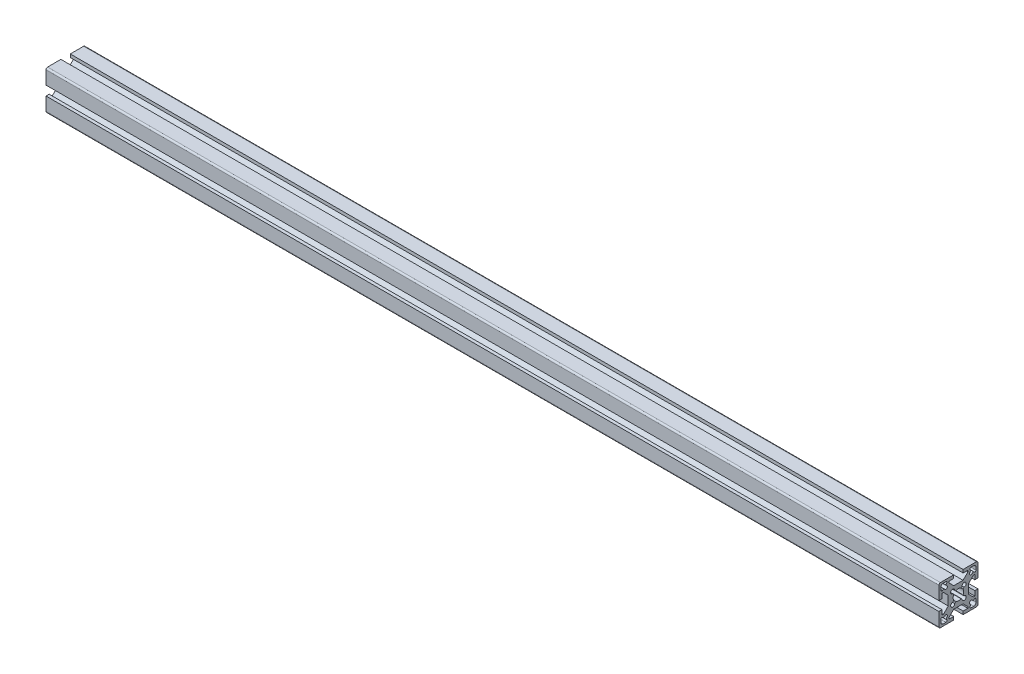
from build123d import *

# Parameters (mm, degrees)
BOSS_EXTRUDE1_DEPTH = 570


with BuildPart() as part:
    # Sketch1 → Boss-Extrude1 (new body)
    with BuildSketch(Plane(origin=(0, 0, 0), x_dir=(0, 0, -1), z_dir=(1, 0, 0))):
        with BuildLine():
            Line((-12.5, 11.5), (-12.5, 3))
            Line((-12.5, 3), (-10.5, 3))
            Line((-10.5, 3), (-10.5, 6))
            Line((-10.5, 6), (-9.535533906, 6))
            Line((-9.535533906, 6), (-6.5, 2.964466094))
            Line((-6.5, 2.964466094), (-6.5, -2.964466094))
            Line((-6.5, -2.964466094), (-9.535533906, -6))
            Line((-9.535533906, -6), (-10.5, -6))
            Line((-10.5, -6), (-10.5, -3))
            Line((-10.5, -3), (-12.5, -3))
            Line((-12.5, -3), (-12.5, -11.5))
            ThreePointArc((-12.5, -11.5), (-12.207106781, -12.207106781), (-11.5, -12.5))
            Line((-11.5, -12.5), (-3, -12.5))
            Line((-3, -12.5), (-3, -10.5))
            Line((-3, -10.5), (-6, -10.5))
            Line((-6, -10.5), (-6, -9.535533906))
            Line((-6, -9.535533906), (-2.964466094, -6.5))
            Line((-2.964466094, -6.5), (2.964466094, -6.5))
            Line((2.964466094, -6.5), (6, -9.535533906))
            Line((6, -9.535533906), (6, -10.5))
            Line((6, -10.5), (3, -10.5))
            Line((3, -10.5), (3, -12.5))
            Line((3, -12.5), (11.5, -12.5))
            ThreePointArc((11.5, -12.5), (12.207106781, -12.207106781), (12.5, -11.5))
            Line((12.5, -11.5), (12.5, -3))
            Line((12.5, -3), (10.5, -3))
            Line((10.5, -3), (10.5, -6))
            Line((10.5, -6), (9.535533906, -6))
            Line((9.535533906, -6), (6.5, -2.964466094))
            Line((6.5, -2.964466094), (6.5, 2.964466094))
            Line((6.5, 2.964466094), (9.535533906, 6))
            Line((9.535533906, 6), (10.5, 6))
            Line((10.5, 6), (10.5, 3))
            Line((10.5, 3), (12.5, 3))
            Line((12.5, 3), (12.5, 11.5))
            ThreePointArc((12.5, 11.5), (12.207106781, 12.207106781), (11.5, 12.5))
            Line((11.5, 12.5), (3, 12.5))
            Line((3, 12.5), (3, 10.5))
            Line((3, 10.5), (6, 10.5))
            Line((6, 10.5), (6, 9.535533906))
            Line((6, 9.535533906), (2.964466094, 6.5))
            Line((2.964466094, 6.5), (-2.964466094, 6.5))
            Line((-2.964466094, 6.5), (-6, 9.535533906))
            Line((-6, 9.535533906), (-6, 10.5))
            Line((-6, 10.5), (-3, 10.5))
            Line((-3, 10.5), (-3, 12.5))
            Line((-3, 12.5), (-11.5, 12.5))
            ThreePointArc((-11.5, 12.5), (-12.207106781, 12.207106781), (-12.5, 11.5))
        make_face()
        with BuildLine():
            Line((-3.087755464, -1.885673936), (-3.585519377, -2.383437849))
            ThreePointArc((-3.585519377, -2.383437849), (-4.599238816, -4.599238816), (-2.383437849, -3.585519377))
            Line((-2.383437849, -3.585519377), (-1.885673936, -3.087755464))
            ThreePointArc((-1.885673936, -3.087755464), (-1.720751743, -3.0036254), (-1.537849315, -3.032329053))
            ThreePointArc((-1.537849315, -3.032329053), (0, -3.4), (1.537849315, -3.032329053))
            ThreePointArc((1.537849315, -3.032329053), (1.720751743, -3.0036254), (1.885673936, -3.087755464))
            Line((1.885673936, -3.087755464), (2.383437849, -3.585519377))
            ThreePointArc((2.383437849, -3.585519377), (4.599238816, -4.599238816), (3.585519377, -2.383437849))
            Line((3.585519377, -2.383437849), (3.087755464, -1.885673936))
            ThreePointArc((3.087755464, -1.885673936), (3.0036254, -1.720751743), (3.032329053, -1.537849315))
            ThreePointArc((3.032329053, -1.537849315), (3.4, 0), (3.032329053, 1.537849315))
            ThreePointArc((3.032329053, 1.537849315), (3.0036254, 1.720751743), (3.087755464, 1.885673936))
            Line((3.087755464, 1.885673936), (3.585519377, 2.383437849))
            ThreePointArc((3.585519377, 2.383437849), (4.599238816, 4.599238816), (2.383437849, 3.585519377))
            Line((2.383437849, 3.585519377), (1.885673936, 3.087755464))
            ThreePointArc((1.885673936, 3.087755464), (1.720751743, 3.0036254), (1.537849315, 3.032329053))
            ThreePointArc((1.537849315, 3.032329053), (0, 3.4), (-1.537849315, 3.032329053))
            ThreePointArc((-1.537849315, 3.032329053), (-1.720751743, 3.0036254), (-1.885673936, 3.087755464))
            Line((-1.885673936, 3.087755464), (-2.383437849, 3.585519377))
            ThreePointArc((-2.383437849, 3.585519377), (-4.599238816, 4.599238816), (-3.585519377, 2.383437849))
            Line((-3.585519377, 2.383437849), (-3.087755464, 1.885673936))
            ThreePointArc((-3.087755464, 1.885673936), (-3.0036254, 1.720751743), (-3.032329053, 1.537849315))
            ThreePointArc((-3.032329053, 1.537849315), (-3.4, 0), (-3.032329053, -1.537849315))
            ThreePointArc((-3.032329053, -1.537849315), (-3.0036254, -1.720751743), (-3.087755464, -1.885673936))
        make_face(mode=Mode.SUBTRACT)
        with BuildLine():
            Line((-11.25, 9.75), (-11.25, 7.976197667))
            ThreePointArc((-11.25, 7.976197667), (-10.817878403, 7.329481994), (-10.055025253, 7.48122292))
            Line((-10.055025253, 7.48122292), (-9.475230868, 8.061017306))
            Line((-9.475230868, 8.061017306), (-8.768124087, 7.353910524))
            ThreePointArc((-8.768124087, 7.353910524), (-7.353910524, 7.353910524), (-7.353910524, 8.768124087))
            Line((-7.353910524, 8.768124087), (-8.061017306, 9.475230868))
            Line((-8.061017306, 9.475230868), (-7.48122292, 10.055025253))
            ThreePointArc((-7.48122292, 10.055025253), (-7.329481994, 10.817878403), (-7.976197667, 11.25))
            Line((-7.976197667, 11.25), (-9.75, 11.25))
            ThreePointArc((-9.75, 11.25), (-10.810660172, 10.810660172), (-11.25, 9.75))
        make_face(mode=Mode.SUBTRACT)
        with BuildLine():
            Line((8.061017306, 9.475230868), (7.353910524, 8.768124087))
            ThreePointArc((7.353910524, 8.768124087), (7.353910524, 7.353910524), (8.768124087, 7.353910524))
            Line((8.768124087, 7.353910524), (9.475230868, 8.061017306))
            Line((9.475230868, 8.061017306), (10.055025253, 7.48122292))
            ThreePointArc((10.055025253, 7.48122292), (10.817878403, 7.329481994), (11.25, 7.976197667))
            Line((11.25, 7.976197667), (11.25, 9.75))
            ThreePointArc((11.25, 9.75), (10.810660172, 10.810660172), (9.75, 11.25))
            Line((9.75, 11.25), (7.976197667, 11.25))
            ThreePointArc((7.976197667, 11.25), (7.329481994, 10.817878403), (7.48122292, 10.055025253))
            Line((7.48122292, 10.055025253), (8.061017306, 9.475230868))
        make_face(mode=Mode.SUBTRACT)
        with BuildLine():
            Line((-9.475230868, -8.061017306), (-10.055025253, -7.48122292))
            ThreePointArc((-10.055025253, -7.48122292), (-10.817878403, -7.329481994), (-11.25, -7.976197667))
            Line((-11.25, -7.976197667), (-11.25, -9.75))
            ThreePointArc((-11.25, -9.75), (-10.810660172, -10.810660172), (-9.75, -11.25))
            Line((-9.75, -11.25), (-7.976197667, -11.25))
            ThreePointArc((-7.976197667, -11.25), (-7.329481994, -10.817878403), (-7.48122292, -10.055025253))
            Line((-7.48122292, -10.055025253), (-8.061017306, -9.475230868))
            Line((-8.061017306, -9.475230868), (-7.353910524, -8.768124087))
            ThreePointArc((-7.353910524, -8.768124087), (-7.353910524, -7.353910524), (-8.768124087, -7.353910524))
            Line((-8.768124087, -7.353910524), (-9.475230868, -8.061017306))
        make_face(mode=Mode.SUBTRACT)
        with BuildLine():
            Line((9.475230868, -8.061017306), (8.768124087, -7.353910524))
            ThreePointArc((8.768124087, -7.353910524), (7.353910524, -7.353910524), (7.353910524, -8.768124087))
            Line((7.353910524, -8.768124087), (8.061017306, -9.475230868))
            Line((8.061017306, -9.475230868), (7.48122292, -10.055025253))
            ThreePointArc((7.48122292, -10.055025253), (7.329481994, -10.817878403), (7.976197667, -11.25))
            Line((7.976197667, -11.25), (9.75, -11.25))
            ThreePointArc((9.75, -11.25), (10.810660172, -10.810660172), (11.25, -9.75))
            Line((11.25, -9.75), (11.25, -7.976197667))
            ThreePointArc((11.25, -7.976197667), (10.817878403, -7.329481994), (10.055025253, -7.48122292))
            Line((10.055025253, -7.48122292), (9.475230868, -8.061017306))
        make_face(mode=Mode.SUBTRACT)
    extrude(amount=BOSS_EXTRUDE1_DEPTH)


solid = part.part
